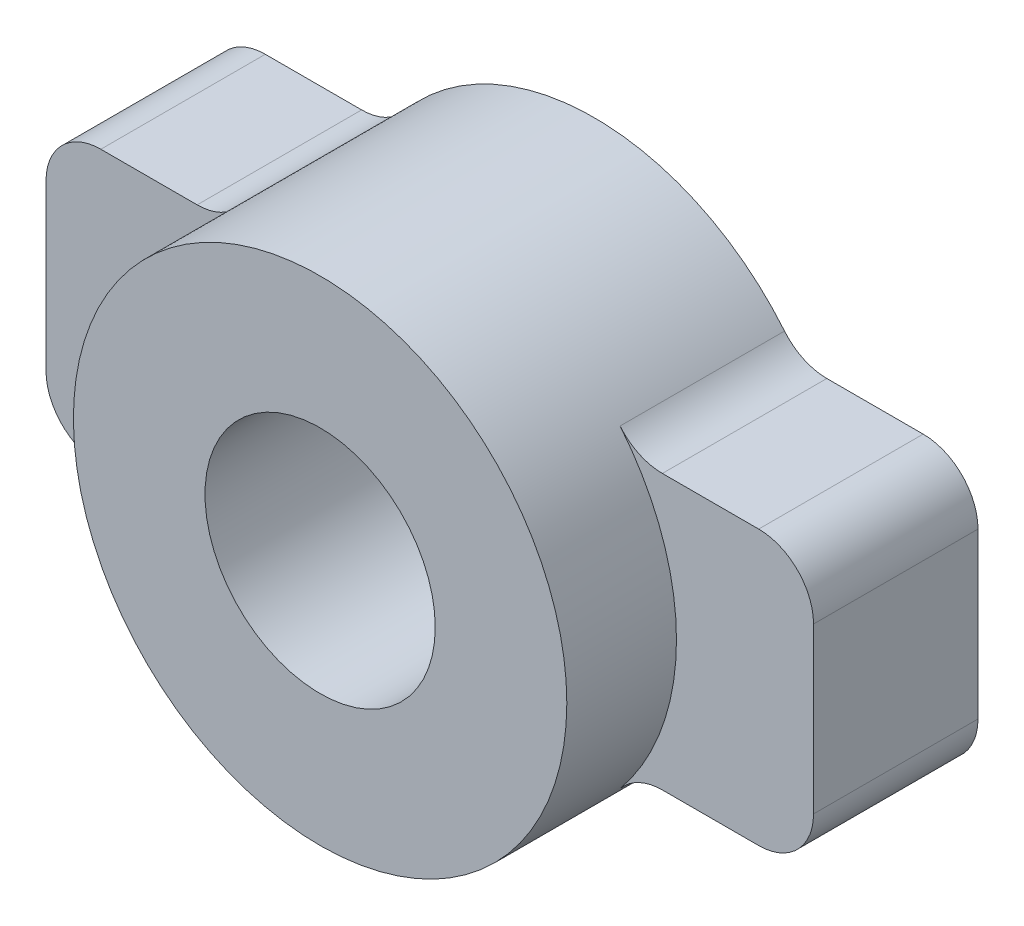
from build123d import *

# Parameters (mm, degrees)
SKETCH_1_R         = 4.5
EXTRUDE_1_DEPTH    = 5
SKETCH_2_W         = 14
SKETCH_2_H         = 5
EXTRUDE_2_DEPTH    = 3
HOLE_WIZARD_M5_1_D = 4.2
FILLET_1_R         = 1


with BuildPart() as part:
    # 草图1 → 凸台-拉伸1 (new body)
    with BuildSketch(Plane.XY):
        Circle(SKETCH_1_R)
    extrude(amount=EXTRUDE_1_DEPTH)

    # 草图2 → 凸台-拉伸2 (add)
    with BuildSketch(Plane(origin=(0, 0, 0), x_dir=(-1, 0, 0), z_dir=(0, 0, -1))):
        Rectangle(SKETCH_2_W, SKETCH_2_H)
    extrude(amount=-EXTRUDE_2_DEPTH)

    # M5 螺纹孔1 (through all)
    with Locations(Plane.XY.offset(5)):
        with Locations((0, 0)):
            Hole(HOLE_WIZARD_M5_1_D / 2)

    # 圆角1
    fillet_1_edges = [part.edges().sort_by_distance(p)[0] for p in [
        (-7, -2.5, 1.5),
        (7, 2.5, 1.5),
        (-7, 2.5, 1.5),
        (-3.741657387, -2.5, 1.5),
        (3.741657387, -2.5, 1.5),
        (7, -2.5, 1.5),
        (3.741657387, 2.5, 1.5),
        (-3.741657387, 2.5, 1.5),
    ]]
    fillet(fillet_1_edges, radius=FILLET_1_R)


solid = part.part
